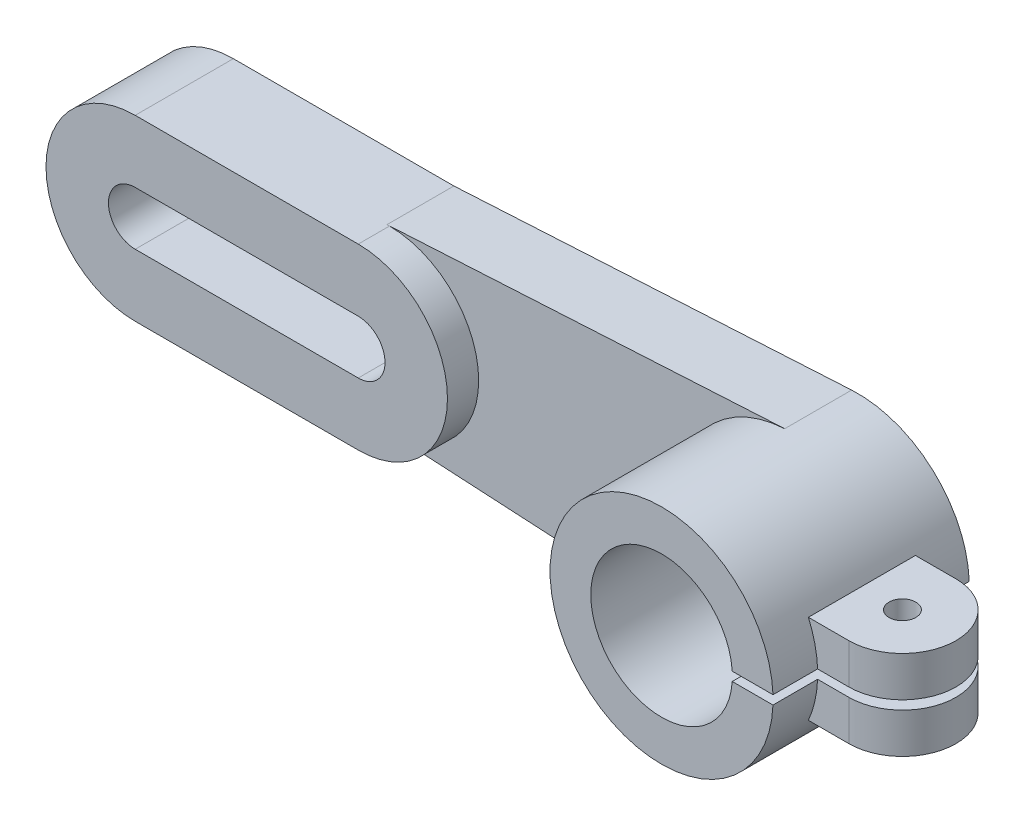
from build123d import *

# Parameters (mm, degrees)
BOSS_EXTRUDE1_DEPTH   = 44
BOSS_EXTRUDE2_START   = -10
BOSS_EXTRUDE2_DEPTH   = 24
BOSS_EXTRUDE3_START   = -22
BOSS_EXTRUDE3_DEPTH   = 22
BOSS_EXTRUDE4_START   = -29
BOSS_EXTRUDE4_DEPTH   = 15
FILLET1_RADIUS        = 12
FILLET1_LENGTH        = 9
FILLET2_RADIUS        = 12
FILLET2_LENGTH        = 9
F_6_0MM_DOWEL_HOLE1_D = 6


with BuildPart() as part:
    # Sketch1 → Boss-Extrude1 (new body)
    with BuildSketch(Plane.XY):
        with BuildLine():
            Line((15.835957699, 1), (24.979991994, 1))
            ThreePointArc((24.979991994, 1), (-25, 0), (24.979991994, -1))
            Line((24.979991994, -1), (15.835957699, -1))
            ThreePointArc((15.835957699, -1), (-15.8675, 0), (15.835957699, 1))
        make_face()
    extrude(amount=-BOSS_EXTRUDE1_DEPTH)

    # Sketch1<3> → Boss-Extrude2 (add)
    with BuildSketch(Plane.XY.offset(BOSS_EXTRUDE2_START)):
        with BuildLine():
            Line((44, 10), (22.912878475, 10))
            ThreePointArc((22.912878475, 10), (24.365585575, 5.596270148), (24.979991994, 1))
            Line((24.979991994, 1), (44, 1))
            Line((44, 1), (44, 10))
        make_face()
        with BuildLine():
            ThreePointArc((24.979991994, -1), (24.365585575, -5.596270148), (22.912878475, -10))
            Line((22.912878475, -10), (44, -10))
            Line((44, -10), (44, -1))
            Line((44, -1), (24.979991994, -1))
        make_face()
    extrude(amount=-BOSS_EXTRUDE2_DEPTH)



with BuildPart() as body_2:
    # Sketch1<4> → Boss-Extrude3 (new body)
    with BuildSketch(Plane.XY.offset(BOSS_EXTRUDE3_START)):
        with BuildLine():
            Line((-140, 20), (-90, 20))
            ThreePointArc((-90, 20), (-70, 0), (-90, -20))
            Line((-90, -20), (-140, -20))
            ThreePointArc((-140, -20), (-160, 0), (-140, 20))
        make_face()
        with BuildLine():
            Line((-140, 6), (-90, 6))
            ThreePointArc((-90, 6), (-84, 0), (-90, -6))
            Line((-90, -6), (-140, -6))
            ThreePointArc((-140, -6), (-146, 0), (-140, 6))
        make_face(mode=Mode.SUBTRACT)
    extrude(amount=-BOSS_EXTRUDE3_DEPTH)


with BuildPart() as part_1:
    add(part.part)

    add(body_2.part)  # Boss-Extrude4 merges body 2
    # Sketch1<5> → Boss-Extrude4 (add)
    with BuildSketch(Plane.XY.offset(BOSS_EXTRUDE4_START)):
        with BuildLine():
            Line((-1.388888889, 24.961389938), (-90.555984888, 20))
            Line((-90.555984888, 20), (-90, 20))
            ThreePointArc((-90, 20), (-70, 0), (-90, -20))
            Line((-90, -20), (-90.555984888, -20))
            Line((-90.555984888, -20), (-1.388888889, -24.961389938))
            ThreePointArc((-1.388888889, -24.961389938), (-25, 0), (-1.388888889, 24.961389938))
        make_face()
    extrude(amount=-BOSS_EXTRUDE4_DEPTH)

    # Fillet1: full round fillet: the end face becomes a half cylinder, R = half its width
    fillet1_face = Plane((44, 5.5, -22), x_dir=(0, 1, 0), z_dir=(1, 0, 0))  # on the end face: x along it, z out of the body
    fillet1_slab = fillet1_face.offset(-FILLET1_RADIUS / 2) * Box(FILLET1_LENGTH, 2 * FILLET1_RADIUS, FILLET1_RADIUS, mode=Mode.PRIVATE)  # the body's end, R deep
    fillet1_round = Plane((32, 5.5, -22), x_dir=(1, 0, 0), z_dir=(0, 1, 0)) * Cylinder(FILLET1_RADIUS, FILLET1_LENGTH, mode=Mode.PRIVATE)  # its axis R under the face
    add(fillet1_slab - fillet1_round, mode=Mode.SUBTRACT)

    # Fillet2: full round fillet: the end face becomes a half cylinder, R = half its width
    fillet2_face = Plane((44, -5.5, -22), x_dir=(0, -1, 0), z_dir=(1, 0, 0))  # on the end face: x along it, z out of the body
    fillet2_slab = fillet2_face.offset(-FILLET2_RADIUS / 2) * Box(FILLET2_LENGTH, 2 * FILLET2_RADIUS, FILLET2_RADIUS, mode=Mode.PRIVATE)  # the body's end, R deep
    fillet2_round = Plane((32, -5.5, -22), x_dir=(1, 0, 0), z_dir=(0, -1, 0)) * Cylinder(FILLET2_RADIUS, FILLET2_LENGTH, mode=Mode.PRIVATE)  # its axis R under the face
    add(fillet2_slab - fillet2_round, mode=Mode.SUBTRACT)

    # Ø6.0mm Dowel Hole1 (through all)
    with Locations(Plane(origin=(32, 10, -22), x_dir=(1, 0, 0), z_dir=(0, 1, 0))):
        with Locations((0, 0)):
            Hole(F_6_0MM_DOWEL_HOLE1_D / 2)


solid = part_1.part
